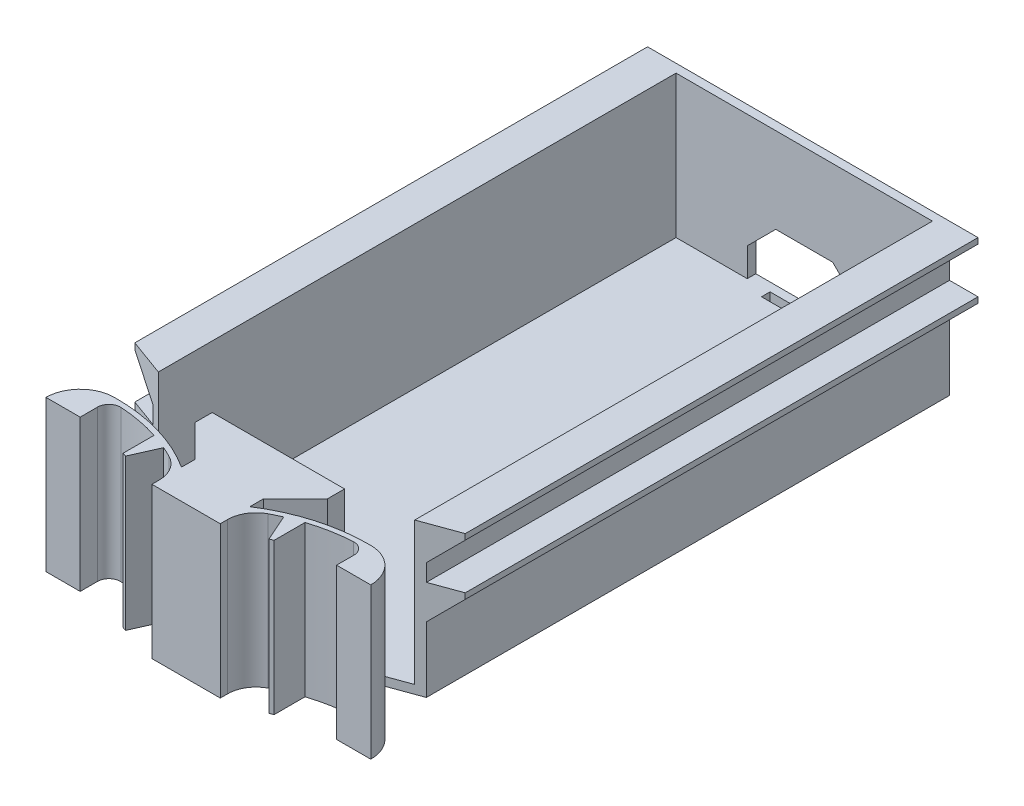
from build123d import *

# Parameters (mm, degrees)
RESSALTO_EXTRUS_O1_DEPTH  = 100
RESSALTO_EXTRUS_O2_DEPTH  = 100
ESBO_O3_W                 = 45
ESBO_O3_H                 = 1.5
RESSALTO_EXTRUS_O3_DEPTH  = 25
CORTE_EXTRUS_O1_DEPTH     = 104.630352696
ESBO_O5_W                 = 12
ESBO_O5_H                 = 1.5
CORTE_EXTRUS_O2_DEPTH     = 108.079409785
CORTE_EXTRUS_O3_DEPTH     = 108.439517869
RESSALTO_EXTRUS_O10_DEPTH = 26.5


with BuildPart() as part:
    # Esboço1 → Ressalto-extrusão1 (new body)
    with BuildSketch(Plane.XY):
        Polygon((-22.5, 12.5), (-22.5, -12.5), (22.5, -12.5), (22.5, 12.5), (24, 12.5), (24, -14), (-24, -14), (-24, 12.5), align=None)
    extrude(amount=RESSALTO_EXTRUS_O1_DEPTH)

    # Esboço2 → Ressalto-extrusão2 (add)
    with BuildSketch(Plane(origin=(0, 0, 0), x_dir=(-1, 0, 0), z_dir=(0, 0, -1))):
        Polygon((-24, 12.5), (-29, 12.5), (-29, 11.5), (-24, 6.5), align=None)
        Polygon((-24, 3.5), (-29, 3.5), (-29, 2.5), (-24, -2.5), align=None)
        Polygon((29, 3.5), (29, 2.5), (24, -2.5), (24, 3.5), align=None)
        Polygon((29, 12.5), (29, 11.5), (24, 6.5), (24, 12.5), align=None)
    extrude(amount=-RESSALTO_EXTRUS_O2_DEPTH)

    # Esboço3 → Ressalto-extrusão3 (add)
    with BuildSketch(Plane(origin=(0, -12.5, 0), x_dir=(1, 0, 0), z_dir=(0, 1, 0))):
        with Locations((0, -0.75)):
            Rectangle(ESBO_O3_W, ESBO_O3_H)
    extrude(amount=RESSALTO_EXTRUS_O3_DEPTH)

    # Esboço4 → Corte-extrusão1 (cut, through all)
    with BuildSketch(Plane.XY.offset(1.5)):
        Polygon((-10, -12.5), (10, -12.5), (10, -7.5), (5, -2.5), (-5, -2.5), (-10, -7.5), align=None)
    extrude(amount=-CORTE_EXTRUS_O1_DEPTH, mode=Mode.SUBTRACT)

    # Esboço5 → Corte-extrusão2 (cut, through all)
    with BuildSketch(Plane(origin=(0, -12.5, 0), x_dir=(1, 0, 0), z_dir=(0, 1, 0))):
        with Locations((0, -2.25)):
            Rectangle(ESBO_O5_W, ESBO_O5_H)
    extrude(amount=-CORTE_EXTRUS_O2_DEPTH, mode=Mode.SUBTRACT)

    # Esboço9 → Corte-extrusão3 (cut, through all)
    with BuildSketch(Plane.XZ.offset(14)):
        Polygon((-12.515135483, 96), (-29, 90), (-29, 100), (-12.515135483, 100), align=None)
        Polygon((29, 100), (29, 90), (12.515135483, 96), (12.515135483, 100), align=None)
    extrude(amount=-CORTE_EXTRUS_O3_DEPTH, mode=Mode.SUBTRACT)

    # Esboço6 → Ressalto-extrusão10 (add, through all)
    with BuildSketch(Plane.XZ.offset(14)):
        with BuildLine():
            Line((-6, 110), (6, 110))
            Line((6, 110), (6, 108.718795841))
            ThreePointArc((6, 108.718795841), (6.720673479, 106.132801926), (8.674945811, 104.292270904))
            ThreePointArc((8.674945811, 104.292270904), (9.598817012, 103.827932437), (10.538733862, 103.396997961))
            Line((10.538733862, 103.396997961), (12.600450366, 108.0363228))
            Line((12.600450366, 108.0363228), (13.247345381, 107.802907073))
            Line((13.247345381, 107.802907073), (13.247345381, 102.372045387))
            ThreePointArc((13.247345381, 102.372045387), (16.773859685, 101.477410085), (20.384927381, 101.033714749))
            ThreePointArc((20.384927381, 101.033714749), (21.87541452, 101.575227938), (22.50318548, 103.031487553))
            Line((22.50318548, 103.031487553), (22.501243671, 106.084324825))
            Line((22.501243671, 106.084324825), (28.501243671, 106.084324825))
            ThreePointArc((28.501243671, 106.084324825), (26.712485124, 101.810515585), (22.412761864, 100.08497728))
            ThreePointArc((22.412761864, 100.08497728), (13.860011295, 101.244470296), (6, 104.810166412))
            Line((6, 104.810166412), (6, 102.41442124))
            Line((6, 102.41442124), (11.616924727, 96.797496513))
            Line((11.616924727, 96.797496513), (11.616924727, 93.797496513))
            Line((11.616924727, 93.797496513), (-11.616924727, 93.797496513))
            Line((-11.616924727, 93.797496513), (-11.616924727, 96.797496513))
            Line((-11.616924727, 96.797496513), (-6, 102.41442124))
            Line((-6, 102.41442124), (-6, 104.810166412))
            ThreePointArc((-6, 104.810166412), (-13.860011295, 101.244470296), (-22.412761864, 100.08497728))
            ThreePointArc((-22.412761864, 100.08497728), (-26.712485124, 101.810515585), (-28.501243671, 106.084324825))
            Line((-28.501243671, 106.084324825), (-22.501243671, 106.084324825))
            Line((-22.501243671, 106.084324825), (-22.50318548, 103.031487553))
            ThreePointArc((-22.50318548, 103.031487553), (-21.87541452, 101.575227938), (-20.384927381, 101.033714749))
            ThreePointArc((-20.384927381, 101.033714749), (-16.773859685, 101.477410085), (-13.247345381, 102.372045387))
            Line((-13.247345381, 102.372045387), (-13.247345381, 107.802907073))
            Line((-13.247345381, 107.802907073), (-12.600450366, 108.0363228))
            Line((-12.600450366, 108.0363228), (-10.538733862, 103.396997961))
            ThreePointArc((-10.538733862, 103.396997961), (-9.598817012, 103.827932437), (-8.674945811, 104.292270904))
            ThreePointArc((-8.674945811, 104.292270904), (-6.720673479, 106.132801926), (-6, 108.718795841))
            Line((-6, 108.718795841), (-6, 110))
        make_face()
    extrude(amount=-RESSALTO_EXTRUS_O10_DEPTH)


solid = part.part
